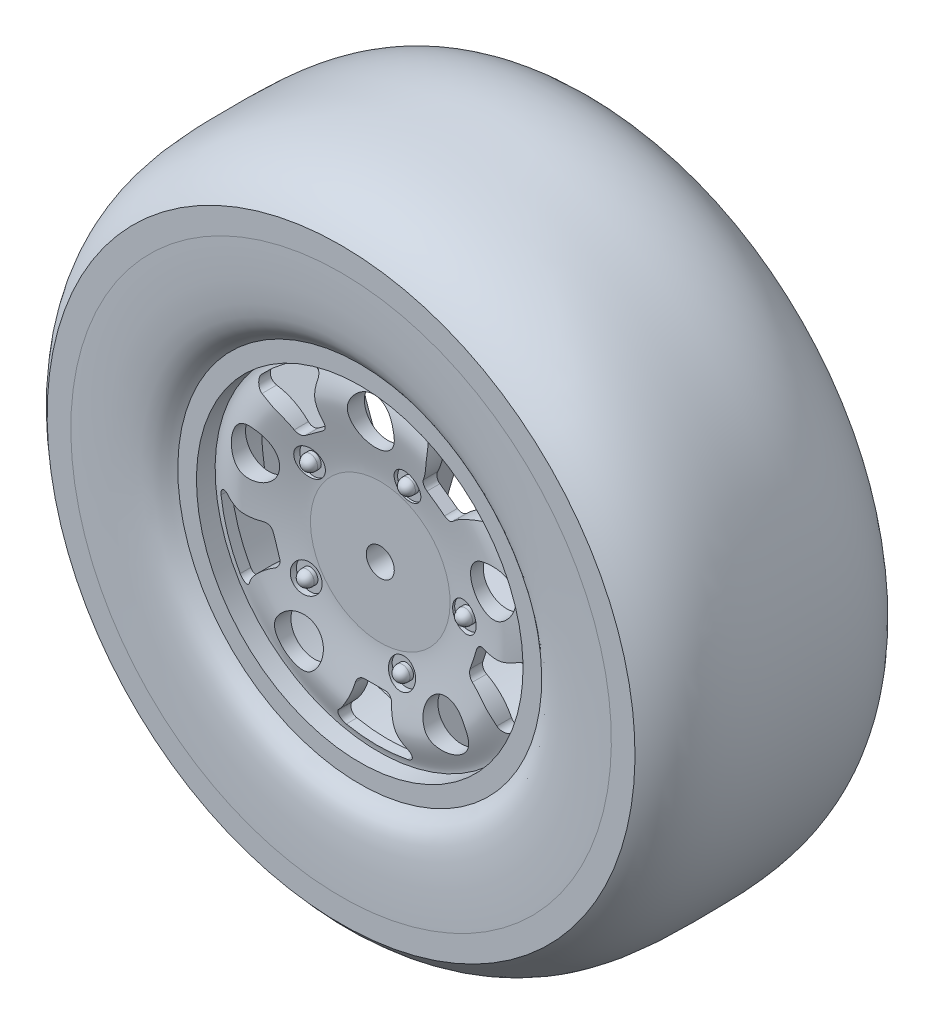
from build123d import *

# Parameters (mm, degrees)
SKETCH2_R           = 3.96875
CUT_EXTRUDE5_DEPTH  = 21.43125
CIRPATTERN1_COUNT   = 5
BOSS_EXTRUDE2_DEPTH = 9.2075
CIRPATTERN2_COUNT   = 5
SKETCH6_R           = 2.38125
CUT_EXTRUDE6_DEPTH  = 3.81
CIRPATTERN3_COUNT   = 5


with BuildPart() as part:
    # Sketch1 → Revolve1 (revolve)
    with BuildSketch(Plane(origin=(0, 0, 0), x_dir=(0, 0, -1), z_dir=(1, 0, 0))):
        with BuildLine():
            add(Edge.make_bspline(
                [(-21.43125, 50.00625), (-16.336485904, 56.447835385), (0, 56.264664615), (16.336485904, 56.447835385), (21.43125, 50.00625)],
                knots=[0, 0, 0, 0, 0.5, 1, 1, 1, 1], degree=3))
            Line((-21.43125, 50.00625), (-21.43125, 45.980514647))
            add(Edge.make_bspline(
                [(-21.43125, 45.980514647), (-21.329292466, 32.455669017), (-20.10944574, 33.691890125), (-18.25625, 30.95625)],
                knots=[0.082597608, 0.082597608, 0.082597608, 0.082597608, 1, 1, 1, 1], degree=3))
            Line((-18.25625, 30.95625), (-18.25625, 27.78125))
            Line((-18.25625, 27.78125), (-15.08125, 27.78125))
            add(Edge.make_bspline(
                [(-15.08125, 27.78125), (-15.128896366, 26.615474684), (-16.360167408, 24.649003793), (-16.504882275, 21.004826754), (-14.884072307, 14.525742149), (-14.76375, 11.876884037)],
                knots=[0, 0, 0, 0, 0.567974024, 0.667974024, 1, 1, 1, 1], degree=3))
            Line((-14.76375, 11.876884037), (-14.76375, 2.38125))
            Line((-14.76375, 2.38125), (-5.55625, 2.38125))
            Line((-5.55625, 2.38125), (-5.55625, 5.55625))
            Line((-5.55625, 5.55625), (-13.49375, 5.55625))
            Line((-13.49375, 5.55625), (-13.49375, 29.36875))
            Line((-13.49375, 29.36875), (-5.55625, 29.36875))
            Line((-5.55625, 29.36875), (-5.55625, 30.95625))
            Line((-5.55625, 30.95625), (-13.49375, 30.95625))
            Line((-13.49375, 30.95625), (-13.49375, 38.89375))
            Line((-13.49375, 38.89375), (19.84375, 38.89375))
            Line((19.84375, 38.89375), (19.84375, 42.06875))
            add(Edge.make_bspline(
                [(21.43125, 48.287471498), (21.402129769, 44.606662612), (21.129172062, 43.696259661), (19.84375, 42.06875)],
                knots=[0.122827942, 0.122827942, 0.122827942, 0.122827942, 1, 1, 1, 1], degree=3))
            Line((21.43125, 48.287471498), (21.43125, 50.00625))
        make_face()
    revolve(axis=Axis((0, 0, -21.43125), (0, 0, 1)))

    # Sketch2 → Cut-Extrude5 (cut)
    with BuildSketch(Plane.XY):
        with BuildLine():
            ThreePointArc((8.873460664, 15.338632961), (8.38508452, 16.069415796), (8.488189354, 16.942298493))
            ThreePointArc((8.488189354, 16.942298493), (9.420217579, 19.8549582), (9.381182181, 22.912856076))
            ThreePointArc((9.381182181, 22.912856076), (9.856373857, 24.138347639), (11.162374244, 24.286670555))
            ThreePointArc((11.162374244, 24.286670555), (15.71092877, 21.624238313), (19.648632952, 18.1210427))
            ThreePointArc((19.648632952, 18.1210427), (19.91114579, 16.83312822), (18.892476357, 16.002496362))
            ThreePointArc((18.892476357, 16.002496362), (15.972180055, 15.09467882), (13.490088621, 13.308205955))
            ThreePointArc((13.490088621, 13.308205955), (12.69178899, 12.940411843), (11.845856684, 13.179060842))
            Line((11.845856684, 13.179060842), (8.873460664, 15.338632961))
        make_face()
        with Locations(Location((0, 21.263903112, 0), (0, 0, 270.000000002))):
            Circle(SKETCH2_R)
    cut_extrude5 = extrude(amount=CUT_EXTRUDE5_DEPTH, mode=Mode.SUBTRACT)

    # CirPattern1: Cut-Extrude5 ×5 about axis
    cirpattern1_axis = Axis((0, 0, 0), (0, 0, 1))
    for i in range(1, CIRPATTERN1_COUNT):
        add(cut_extrude5.rotate(cirpattern1_axis, i * 360 / CIRPATTERN1_COUNT), mode=Mode.SUBTRACT)

    # Sketch5 → Boss-Extrude2 (add)
    with BuildSketch(Plane.XY.offset(14.76375)):
        Polygon((0.533180289, 3.262823298), (1.295508737, 3.041702517), (13.923704847, 46.578240019), (13.279104247, 47.205235306), align=None)
    boss_extrude2 = extrude(amount=-BOSS_EXTRUDE2_DEPTH)

    # CirPattern2: Boss-Extrude2 ×5 about axis
    cirpattern2_axis = Axis((0, 0, 0), (0, 0, 1))
    for i in range(1, CIRPATTERN2_COUNT):
        add(boss_extrude2.rotate(cirpattern2_axis, i * 360 / CIRPATTERN2_COUNT))

    # Sketch6 → Cut-Extrude6 (cut)
    with BuildSketch(Plane.XY.offset(18.25625)):
        with Locations((5.013172481, 13.852794869)):
            Circle(SKETCH6_R)
    cut_extrude6 = extrude(amount=-CUT_EXTRUDE6_DEPTH, mode=Mode.SUBTRACT)

    # Sketch8 → Revolve2 (revolve)
    with BuildSketch(Plane(origin=(0, 0, 0), x_dir=(0, 0, -1), z_dir=(0.9403200426831747, -0.3402913712222402, 0)), mode=Mode.PRIVATE) as revolve2_sk:
        with BuildLine():
            Line((-14.114473283, 14.732), (-16.343731459, 14.732))
            ThreePointArc((-16.343731459, 14.732), (-15.971757071, 15.630025612), (-15.073731459, 16.002))
            Line((-15.073731459, 16.002), (-14.114473283, 16.002))
            Line((-14.114473283, 16.002), (-14.114473283, 14.732))
        make_face()
    revolve2 = revolve(revolve2_sk.sketch.rotate(Axis((5.013172481, 13.852794869, 14.114473283), (0, 0, 1)), 19.894626968), axis=Axis((5.013172481, 13.852794869, 14.114473283), (0, 0, 1)))

    # CirPattern3: Cut-Extrude6, Revolve2 ×5 about axis
    cirpattern3_axis = Axis((0, 0, 0), (0, 0, 1))
    add([cut_extrude6.rotate(cirpattern3_axis, i * 360 / CIRPATTERN3_COUNT) for i in range(1, CIRPATTERN3_COUNT)], mode=Mode.SUBTRACT)
    add([revolve2.rotate(cirpattern3_axis, i * 360 / CIRPATTERN3_COUNT) for i in range(1, CIRPATTERN3_COUNT)])


solid = part.part
